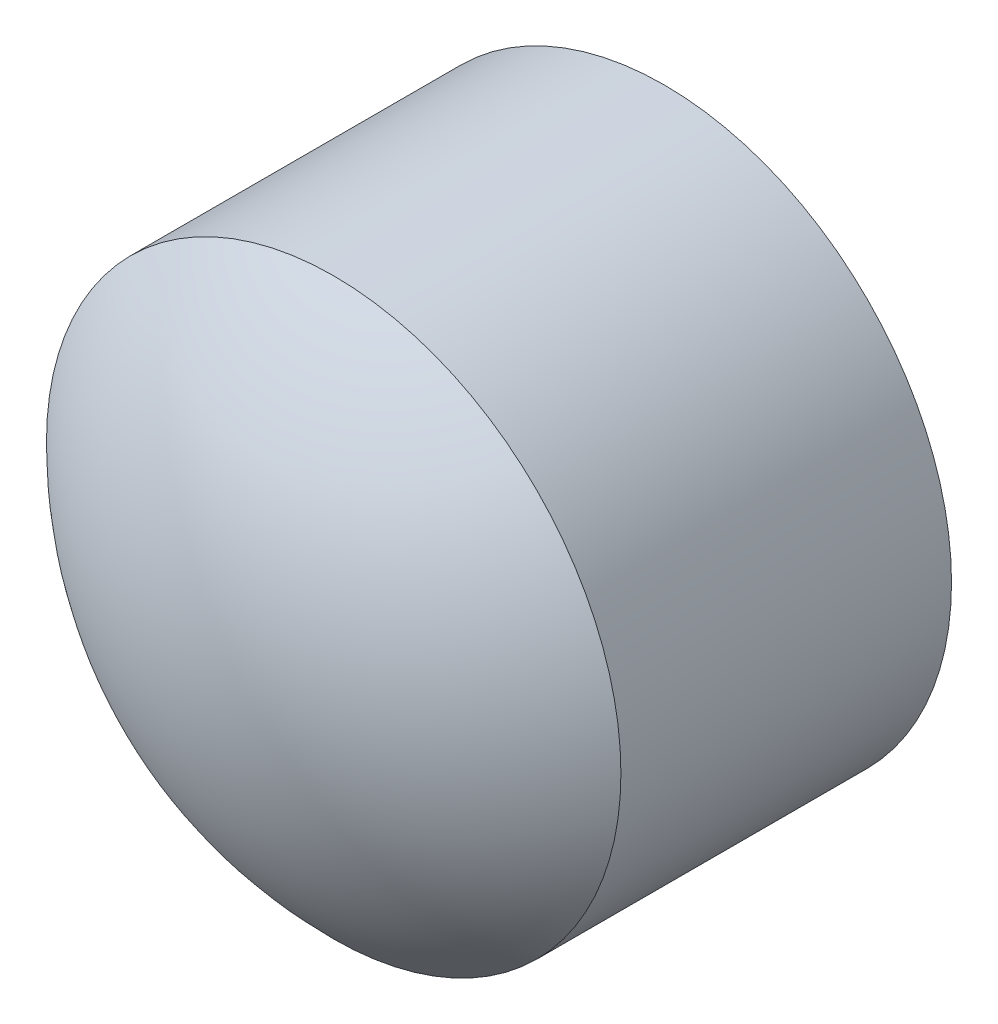
from build123d import *

# Parameters (mm, degrees)
ESBO_O1_R                = 6.95
RESSALTO_EXTRUS_O1_DEPTH = 8
ESBO_O2_R                = 6.5
CORTE_EXTRUS_O1_DEPTH    = 4
ESBO_O3_R                = 5.5
CORTE_EXTRUS_O2_DEPTH    = 11.611550311


with BuildPart() as part:
    # Esboço1 → Ressalto-extrusão1 (new body)
    with BuildSketch(Plane.XY):
        Circle(ESBO_O1_R)
    extrude(amount=RESSALTO_EXTRUS_O1_DEPTH)

    # Esboço2 → Corte-extrusão1 (cut)
    with BuildSketch(Plane.XY.offset(8)):
        Circle(ESBO_O2_R)
    extrude(amount=-CORTE_EXTRUS_O1_DEPTH, mode=Mode.SUBTRACT)

    # Esboço3 → Corte-extrusão2 (cut, through all)
    with BuildSketch(Plane.XY.offset(4)):
        Circle(ESBO_O3_R)
    extrude(amount=-CORTE_EXTRUS_O2_DEPTH, mode=Mode.SUBTRACT)

    # Esboço4 → Revolução1 (revolve)
    with BuildSketch(Plane(origin=(0, 0, 0), x_dir=(1, 0, 0), z_dir=(0, 1, 0))):
        with BuildLine():
            Line((-6.95, -8), (-6.5, -8))
            Line((-6.5, -8), (-6.5, -6.423040188))
            Line((-6.5, -6.423040188), (-4.052357622, -6.423040188))
            ThreePointArc((-4.052357622, -6.423040188), (-2.736736603, -9.045296291), (0, -10.10234809))
            Line((0, -10.10234809), (0, -10.899494937))
            ThreePointArc((0, -10.899494937), (-3.765287867, -10.145558539), (-6.95, -8))
        make_face()
    revolve(axis=Axis((0, 0, 0), (0, 0, 1)))

    # Esboço5 → Revolução2 (revolve)
    with BuildSketch(Plane(origin=(0, 0, 0), x_dir=(1, 0, 0), z_dir=(0, 1, 0)), mode=Mode.PRIVATE) as revolu_o2_sk:
        with BuildLine():
            Line((-3.713977707, -5.421872189), (-3.713977707, -6.04883524))
            ThreePointArc((-3.713977707, -6.04883524), (-1.937414068, -6.871607812), (0, -7.153671279))
            Line((0, -7.153671279), (0, -6.423040188))
            ThreePointArc((0, -6.423040188), (-1.744054919, -5.991033293), (-3.084817583, -4.794909137))
            Line((-3.084817583, -4.794909137), (-3.713977707, -4.794909137))
            Line((-3.713977707, -4.794909137), (-3.713977707, -3.721064783))
            Line((-3.713977707, -3.721064783), (-5.5, -3.721064783))
            Line((-5.5, -3.721064783), (-5.5, -5.421872189))
            Line((-5.5, -5.421872189), (-3.713977707, -5.421872189))
        make_face()
    revolve(revolu_o2_sk.sketch.rotate(Axis((0, 0, 10.899494937), (0, 0, -1)), 180), axis=Axis((0, 0, 10.899494937), (0, 0, -1)))

    # Esboço7 → Revolução3 (revolve)
    with BuildSketch(Plane(origin=(0, 0, 0), x_dir=(1, 0, 0), z_dir=(0, 1, 0)), mode=Mode.PRIVATE) as revolu_o3_sk:
        with BuildLine():
            Line((-2.735445453, -4.263680727), (-2.735445453, -3.250344697))
            Line((-2.735445453, -3.250344697), (-5.5, -3.250344697))
            Line((-5.5, -3.250344697), (-5.5, -2.605717645))
            Line((-5.5, -2.605717645), (-2.735445453, -2.605717645))
            Line((-2.735445453, -2.605717645), (-2.735445453, -2.145225421))
            ThreePointArc((-2.735445453, -2.145225421), (-1.373890676, -1.95031325), (0, -1.885147489))
            Line((0, -1.885147489), (0, -3.721064783))
            ThreePointArc((0, -3.721064783), (-1.394372071, -3.858027591), (-2.735445453, -4.263680727))
        make_face()
    revolve(revolu_o3_sk.sketch.rotate(Axis((0, 0, 10.899494937), (0, 0, -1)), 180), axis=Axis((0, 0, 10.899494937), (0, 0, -1)))


solid = part.part
